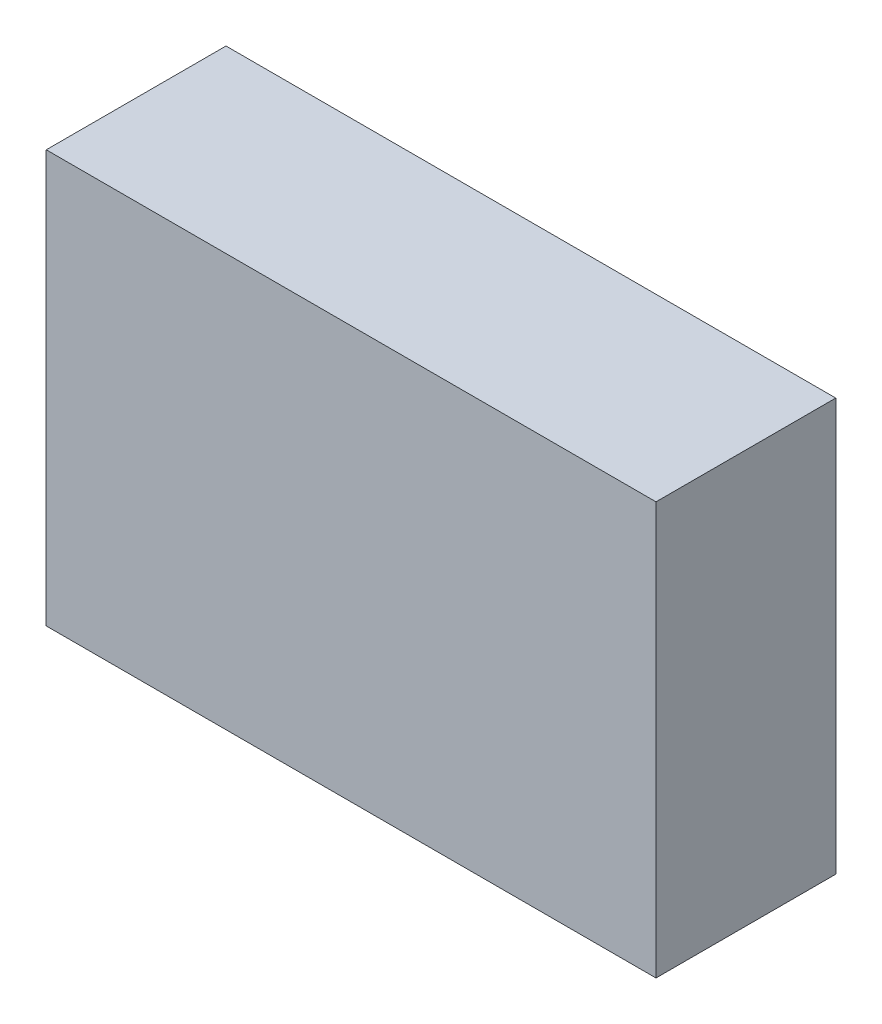
from build123d import *

# Parameters (mm, degrees)
SKETCH1_W           = 17.3
SKETCH1_H           = 11.7
BOSS_EXTRUDE1_DEPTH = 5.1


with BuildPart() as part:
    # Sketch1 → Boss-Extrude1 (new body)
    with BuildSketch(Plane.XY):
        with Locations((8.65, 5.85)):
            Rectangle(SKETCH1_W, SKETCH1_H)
    extrude(amount=BOSS_EXTRUDE1_DEPTH)


solid = part.part
